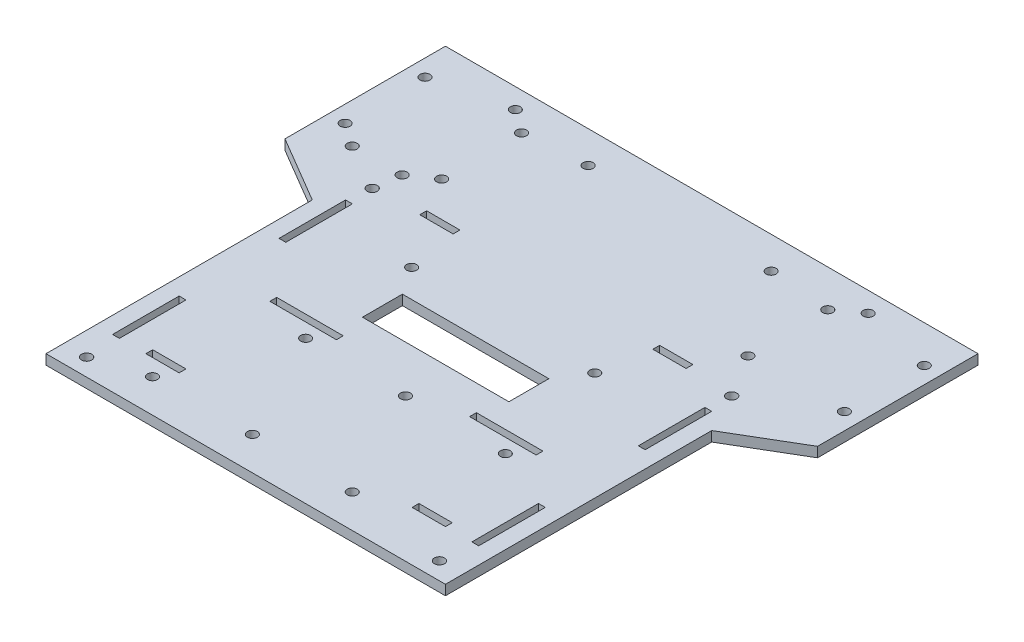
from build123d import *

# Parameters (mm, degrees)
SKETCH1_W           = 120
SKETCH1_H           = 140
BOSS_EXTRUDE1_DEPTH = 3
SKETCH2_R           = 1.5
CUT_EXTRUDE1_DEPTH  = 107.343782141
SKETCH3_R           = 1.5
CUT_EXTRUDE3_DEPTH  = 107.343782141
SKETCH4_R           = 1.5
CUT_EXTRUDE4_DEPTH  = 107.343782141
SKETCH5_R           = 1.5
CUT_EXTRUDE5_DEPTH  = 3
SKETCH6_R           = 1.525
SKETCH6_W           = 10
SKETCH6_H           = 2.05
SKETCH6_W_2         = 20
CUT_EXTRUDE7_DEPTH  = 107.343782141
SKETCH9_R           = 1.525
CUT_EXTRUDE8_DEPTH  = 3
SKETCH10_W          = 44
SKETCH10_H          = 12
CUT_EXTRUDE9_DEPTH  = 5
SKETCH11_R          = 1.5
CUT_EXTRUDE10_DEPTH = 5
SKETCH12_W          = 2.05
SKETCH12_H          = 20
CUT_EXTRUDE11_DEPTH = 10


with BuildPart() as part:
    # Sketch1 → Boss-Extrude1 (new body)
    with BuildSketch(Plane(origin=(0, 0, 0), x_dir=(1, 0, 0), z_dir=(0, 1, 0))):
        Rectangle(SKETCH1_W, SKETCH1_H)
        Polygon((-80, 21.791828604), (-60, 10), (-60, 70), (-80, 70), align=None)
        Polygon((80, 70), (60, 70), (60, 10), (80, 21.791828604), align=None)
    extrude(amount=BOSS_EXTRUDE1_DEPTH)

    # Sketch2 → Cut-Extrude1 (cut, through all)
    with BuildSketch(Plane(origin=(0, 3, 0), x_dir=(1, 0, 0), z_dir=(0, 1, 0))):
        with Locations(Location((-38, -60, 0), (0, 0, 270))):
            Circle(SKETCH2_R)
        with Locations(Location((-25, -27, 0), (0, 0, 270))):
            Circle(SKETCH2_R)
        with Locations(Location((5, -27, 0), (0, 0, 270))):
            Circle(SKETCH2_R)
        with Locations(Location((-8, -60, 0), (0, 0, 270))):
            Circle(SKETCH2_R)
        with Locations(Location((35, -27, 0), (0, 0, 270))):
            Circle(SKETCH2_R)
        with Locations(Location((22, -60, 0), (0, 0, 270))):
            Circle(SKETCH2_R)
    extrude(amount=-CUT_EXTRUDE1_DEPTH, mode=Mode.SUBTRACT)

    # Sketch3 → Cut-Extrude3 (cut, through all)
    with BuildSketch(Plane(origin=(0, 3, 0), x_dir=(1, 0, 0), z_dir=(0, 1, 0))):
        with Locations(Location((-27.529579069, 60.385555627, 0), (0, 0, 270))):
            Circle(SKETCH3_R)
        with Locations(Location((-27.529579069, 7.385555627, 0), (0, 0, 90))):
            Circle(SKETCH3_R)
        with Locations(Location((27.470420931, 7.385555627, 0), (0, 0, 270))):
            Circle(SKETCH3_R)
        with Locations(Location((27.470420931, 60.385555627, 0), (0, 0, 90))):
            Circle(SKETCH3_R)
    extrude(amount=-CUT_EXTRUDE3_DEPTH, mode=Mode.SUBTRACT)

    # Sketch4 → Cut-Extrude4 (cut, through all)
    with BuildSketch(Plane(origin=(0, 3, 0), x_dir=(1, 0, 0), z_dir=(0, 1, 0))):
        with Locations(Location((-75, 34.863883517, 0), (0, 0, 270))):
            Circle(SKETCH4_R)
        with Locations(Location((-75, 58.863883517, 0), (0, 0, 270))):
            Circle(SKETCH4_R)
        with Locations(Location((-46, 34.863883517, 0), (0, 0, 90))):
            Circle(SKETCH4_R)
        with Locations(Location((-46, 58.863883517, 0), (0, 0, 90))):
            Circle(SKETCH4_R)
        with Locations(Location((46, 58.863883517, 0), (0, 0, 270))):
            Circle(SKETCH4_R)
        with Locations(Location((46, 34.863883517, 0), (0, 0, 270))):
            Circle(SKETCH4_R)
        with Locations(Location((75, 34.863883517, 0), (0, 0, 90))):
            Circle(SKETCH4_R)
        with Locations(Location((75, 58.863883517, 0), (0, 0, 90))):
            Circle(SKETCH4_R)
    extrude(amount=-CUT_EXTRUDE4_DEPTH, mode=Mode.SUBTRACT)

    # Sketch5 → Cut-Extrude5 (cut)
    with BuildSketch(Plane(origin=(0, 3, 0), x_dir=(1, 0, 0), z_dir=(0, 1, 0))):
        with Locations(Location((-68, 30, 0), (0, 0, 270))):
            Circle(SKETCH5_R)
        with Locations(Location((-53, 30, 0), (0, 0, 270))):
            Circle(SKETCH5_R)
    extrude(amount=-CUT_EXTRUDE5_DEPTH, mode=Mode.SUBTRACT)

    # Sketch6 → Cut-Extrude7 (cut, through all)
    with BuildSketch(Plane(origin=(0, 3, 0), x_dir=(1, 0, 0), z_dir=(0, 1, 0))):
        with Locations(Location((-53, -64.8, 0), (0, 0, 270))):
            Circle(SKETCH6_R)
        with Locations(Location((53, -64.8, 0), (0, 0, 90))):
            Circle(SKETCH6_R)
        with Locations((-40, -53.975)):
            Rectangle(SKETCH6_W, SKETCH6_H)
        with Locations((40, -53.975)):
            Rectangle(SKETCH6_W, SKETCH6_H)
        with Locations((30, -21.725)):
            Rectangle(SKETCH6_W_2, SKETCH6_H)
        with Locations((-30, -21.725)):
            Rectangle(SKETCH6_W_2, SKETCH6_H)
        with Locations((35, 23.325)):
            Rectangle(SKETCH6_W, SKETCH6_H)
        with Locations((-35, 23.325)):
            Rectangle(SKETCH6_W, SKETCH6_H)
    extrude(amount=-CUT_EXTRUDE7_DEPTH, mode=Mode.SUBTRACT)

    # Sketch9 → Cut-Extrude8 (cut)
    with BuildSketch(Plane(origin=(0, 3, 0), x_dir=(1, 0, 0), z_dir=(0, 1, 0))):
        with Locations(Location((-54, 22, 0), (0, 0, 270))):
            Circle(SKETCH9_R)
        with Locations(Location((54, 22, 0), (0, 0, 90))):
            Circle(SKETCH9_R)
    extrude(amount=-CUT_EXTRUDE8_DEPTH, mode=Mode.SUBTRACT)

    # Sketch10 → Cut-Extrude9 (cut)
    with BuildSketch(Plane(origin=(0, 3, 0), x_dir=(1, 0, 0), z_dir=(0, 1, 0))):
        with Locations((0.046472237, -6.975074484)):
            Rectangle(SKETCH10_W, SKETCH10_H)
    extrude(amount=-CUT_EXTRUDE9_DEPTH, mode=Mode.SUBTRACT)

    # Sketch11 → Cut-Extrude10 (cut)
    with BuildSketch(Plane(origin=(0, 3, 0), x_dir=(1, 0, 0), z_dir=(0, 1, 0))):
        with Locations(Location((-53, 64, 0), (0, 0, 270))):
            Circle(SKETCH11_R)
        with Locations(Location((53, 64, 0), (0, 0, 270))):
            Circle(SKETCH11_R)
    extrude(amount=-CUT_EXTRUDE10_DEPTH, mode=Mode.SUBTRACT)

    # Sketch12 → Cut-Extrude11 (cut)
    with BuildSketch(Plane(origin=(0, 3, 0), x_dir=(1, 0, 0), z_dir=(0, 1, 0))):
        with Locations((-53.975, 5)):
            Rectangle(SKETCH12_W, SKETCH12_H)
        with Locations((-53.975, -45)):
            Rectangle(SKETCH12_W, SKETCH12_H)
        with Locations((53.975, -45)):
            Rectangle(SKETCH12_W, SKETCH12_H)
        with Locations((53.975, 5)):
            Rectangle(SKETCH12_W, SKETCH12_H)
    extrude(amount=-CUT_EXTRUDE11_DEPTH, mode=Mode.SUBTRACT)


solid = part.part
